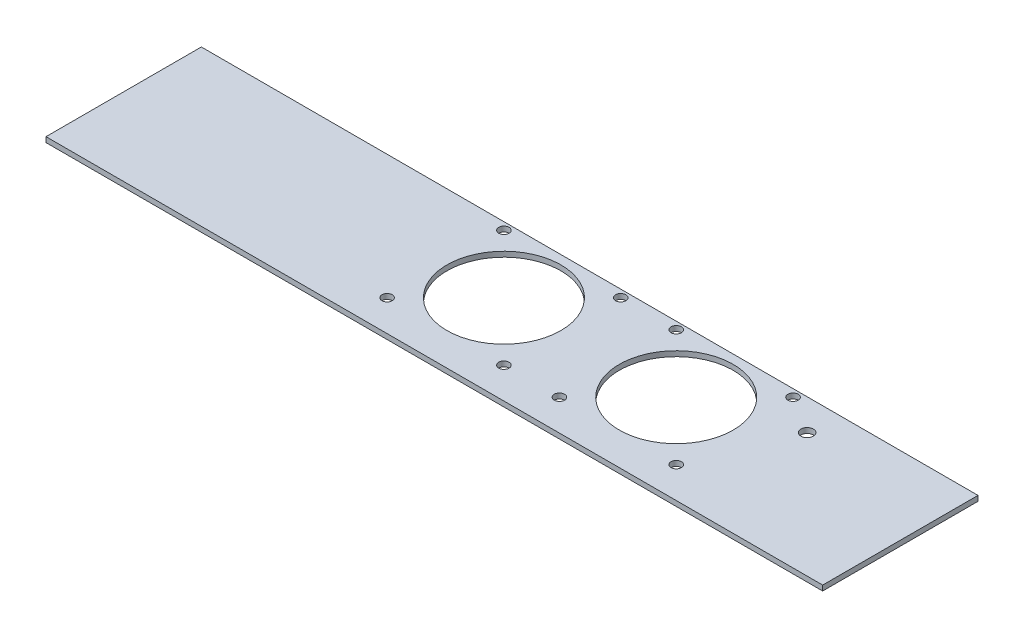
from build123d import *

# Parameters (mm, degrees)
BOSS_EXTRUDE1_DEPTH = 95.25
SKETCH2_R           = 3.175
CUT_EXTRUDE1_DEPTH  = 152.4
SKETCH4_R           = 34.925
SKETCH4_R_2         = 3.81
CUT_EXTRUDE2_DEPTH  = 381
SKETCH5_R           = 3.81
CUT_EXTRUDE3_DEPTH  = 12.7
SKETCH6_W           = 95.25
SKETCH6_H           = 377.825
CUT_EXTRUDE4_DEPTH  = 613.404745654
SKETCH7_W           = 95.25
SKETCH7_H           = 3.175
BOSS_EXTRUDE2_DEPTH = 3.175


with BuildPart() as part:
    # Sketch1 → Boss-Extrude1 (new body)
    with BuildSketch(Plane.XY):
        Polygon((0, 0), (0, 381), (3.175, 381), (3.175, 3.175), (473.075, 3.175), (473.075, 0), align=None)
    extrude(amount=BOSS_EXTRUDE1_DEPTH)

    # Sketch2 → Cut-Extrude1 (cut)
    with BuildSketch(Plane(origin=(0, 3.175, 0), x_dir=(1, 0, 0), z_dir=(0, 1, 0))):
        with Locations(Location((190.119, -4.572, 0), (0, 0, 180))):
            Circle(SKETCH2_R)
        with Locations(Location((190.119, -76.2, 0), (0, 0, 180))):
            Circle(SKETCH2_R)
        with Locations(Location((261.747, -4.572, 0), (0, 0, 180))):
            Circle(SKETCH2_R)
        with Locations(Location((261.747, -76.2, 0), (0, 0, 180))):
            Circle(SKETCH2_R)
        with Locations(Location((295.783, -76.2, 0), (0, 0, 180))):
            Circle(SKETCH2_R)
        with Locations(Location((295.783, -4.572, 0), (0, 0, 180))):
            Circle(SKETCH2_R)
        with Locations(Location((367.411, -76.2, 0), (0, 0, 180))):
            Circle(SKETCH2_R)
        with Locations(Location((367.411, -4.572, 0), (0, 0, 180))):
            Circle(SKETCH2_R)
    extrude(amount=-CUT_EXTRUDE1_DEPTH, mode=Mode.SUBTRACT)

    # Sketch4 → Cut-Extrude2 (cut)
    with BuildSketch(Plane.XZ):
        with Locations((225.933, 40.386)):
            Circle(SKETCH4_R)
        with Locations((331.597, 40.386)):
            Circle(SKETCH4_R)
        with Locations((390.525, 19.05)):
            Circle(SKETCH4_R_2)
    extrude(amount=-CUT_EXTRUDE2_DEPTH, mode=Mode.SUBTRACT)

    # Sketch5 → Cut-Extrude3 (cut)
    with BuildSketch(Plane.ZY):
        with Locations((19.05, 349.25)):
            Circle(SKETCH5_R)
    extrude(amount=-CUT_EXTRUDE3_DEPTH, mode=Mode.SUBTRACT)

    # Sketch6 → Cut-Extrude4 (cut, through all)
    with BuildSketch(Plane(origin=(3.175, 0, 0), x_dir=(0, 0, -1), z_dir=(1, 0, 0))):
        with Locations((-47.625, 192.0875)):
            Rectangle(SKETCH6_W, SKETCH6_H)
    extrude(amount=-CUT_EXTRUDE4_DEPTH, mode=Mode.SUBTRACT)

    # Sketch7 → Boss-Extrude2 (add)
    with BuildSketch(Plane(origin=(473.075, 0, 0), x_dir=(0, 0, -1), z_dir=(1, 0, 0))):
        with Locations((-47.625, 1.5875)):
            Rectangle(SKETCH7_W, SKETCH7_H)
    extrude(amount=BOSS_EXTRUDE2_DEPTH)


solid = part.part
